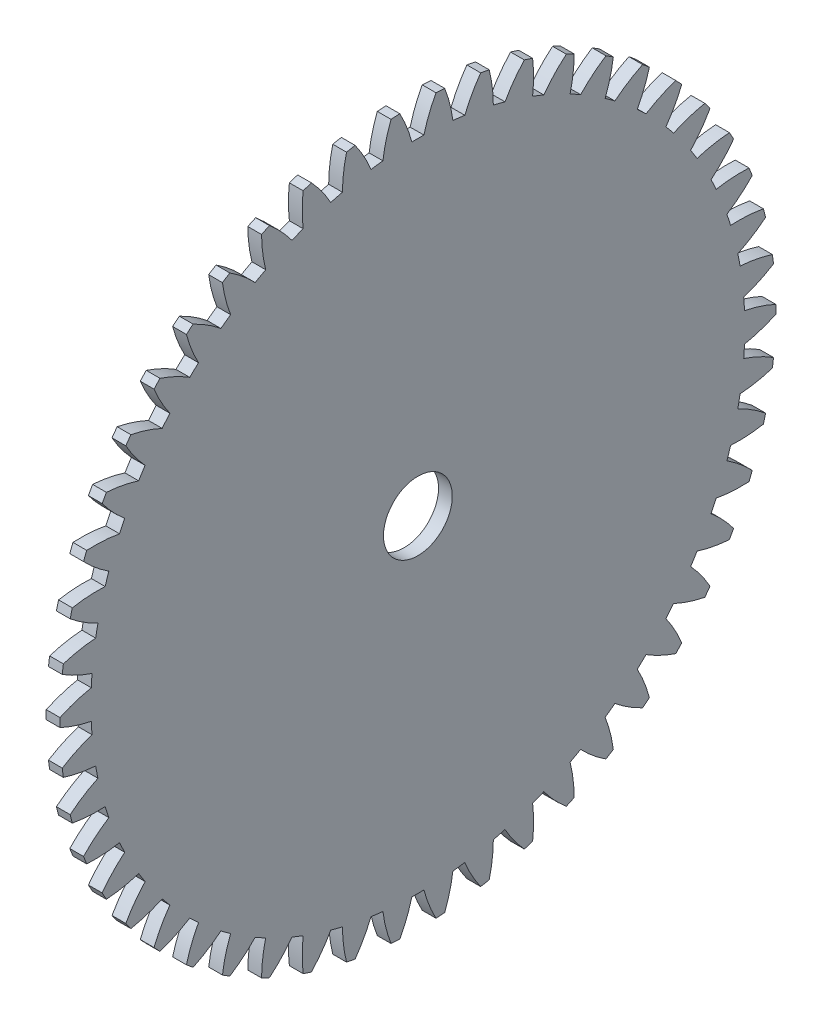
from build123d import *

# Parameters (mm, degrees)
BASPROSKE_W     = 1
BASPROSKE_H     = 26
TOOTHCUT_DEPTH  = 37.783148315
TEETHCUTS_COUNT = 50
TEETHCUTS_ANGLE = 352.8
BORSKE_R        = 2.5
BORE_DEPTH      = 50.0000508


with BuildPart() as part:
    # BasProSke → Base-Revolve (revolve)
    with BuildSketch(Plane(origin=(0, 0, 0), x_dir=(1, 0, 0), z_dir=(0, 1, 0)), mode=Mode.PRIVATE) as base_revolve_sk:
        with Locations((0.5, 13)):
            Rectangle(BASPROSKE_W, BASPROSKE_H)
    revolve(base_revolve_sk.sketch.rotate(Axis((-10, 0, 0), (1, 0, 0)), 180), axis=Axis((-10, 0, 0), (1, 0, 0)))

    # TooCutSke → ToothCut (cut, through all)
    with BuildSketch(Plane(origin=(0, 0, 0), x_dir=(0, 0, -1), z_dir=(1, 0, 0))):
        with BuildLine():
            ThreePointArc((0.437663408, 23.744966872), (0, 23.749), (-0.437663408, 23.744966872))
            ThreePointArc((-0.437663408, 23.744966872), (-0.815428123, 24.895236298), (-1.329433358, 25.991422664))
            ThreePointArc((-1.329433358, 25.991422664), (0, 26.0254), (1.329433358, 25.991422664))
            ThreePointArc((1.329433358, 25.991422664), (0.815428123, 24.895236298), (0.437663408, 23.744966872))
        make_face()
    toothcut = extrude(amount=TOOTHCUT_DEPTH, mode=Mode.SUBTRACT)

    # TeethCuts: ToothCut ×50 about axis
    teethcuts_axis = Axis((-10, 0, 0), (1, 0, 0))
    for i in range(1, TEETHCUTS_COUNT):
        add(toothcut.rotate(teethcuts_axis, i * TEETHCUTS_ANGLE / (TEETHCUTS_COUNT - 1)), mode=Mode.SUBTRACT)

    # BorSke → Bore (cut, symmetric)
    with BuildSketch(Plane(origin=(0, 0, 0), x_dir=(0, 0, -1), z_dir=(1, 0, 0))):
        with Locations(Location((0, 0, 0), (0, 0, 180))):
            Circle(BORSKE_R)
    extrude(amount=BORE_DEPTH, both=True, mode=Mode.SUBTRACT)


solid = part.part
